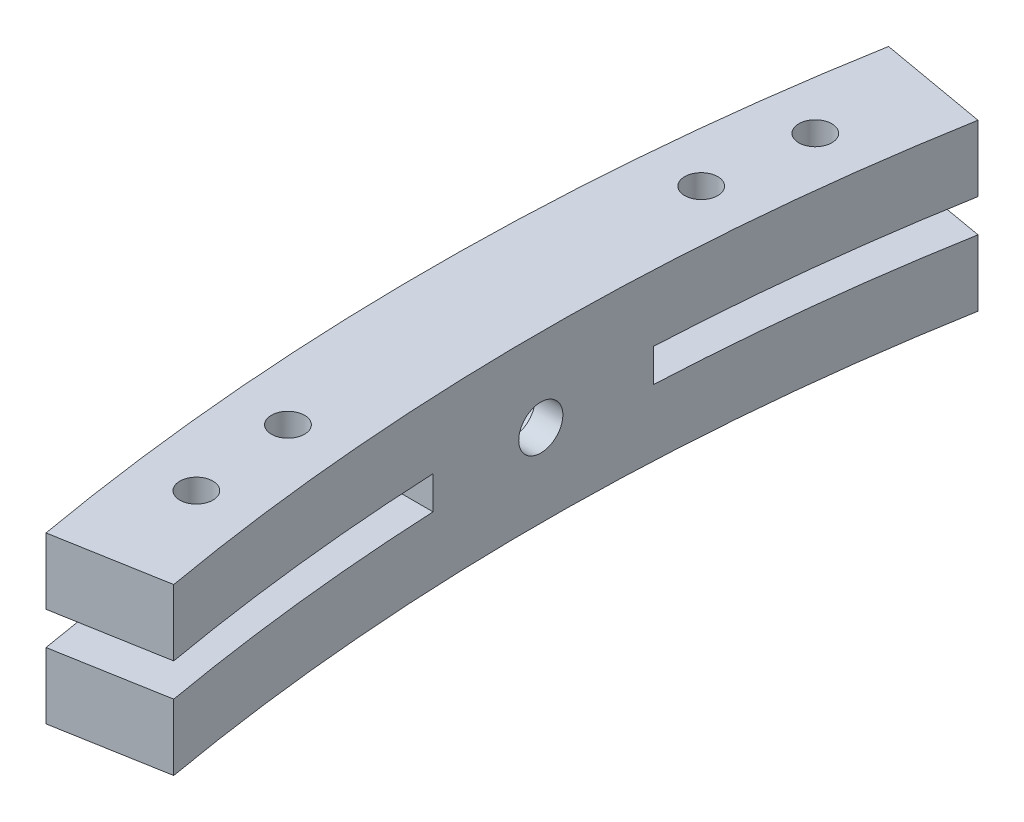
from build123d import *

# Parameters (mm, degrees)
BASE2_DEPTH            = 7.5
MOUNT2_START           = -1.5
MOUNT2_DEPTH           = 3
MOUNT_HOLE2_DEPTH      = 224.418192135
MOUNT_HOLE2_DEPTH_BACK = 224.418192135
SKETCH16_R             = 1.5
SKETCH17_R             = 2
SHAFT_HOLE_DEPTH       = 40.784051683
SKETCH18_W             = 2.5
SKETCH18_H             = 3.5


with BuildPart() as part:
    # Sketch13 → base2 (new, symmetric)
    with BuildSketch(Plane(origin=(0, 0, 0), x_dir=(1, 0, 0), z_dir=(0, 1, 0))):
        with BuildLine():
            ThreePointArc((-209.761769634, 10), (-208.70564487, 23.279901188), (-206.809628133, 36.46611731))
            Line((-206.809628133, 36.46611731), (-216.657705663, 38.202599087))
            ThreePointArc((-216.657705663, 38.202599087), (-218.670303662, 24.151569236), (-219.772609758, 10))
            Line((-219.772609758, 10), (-209.761769634, 10))
        make_face()
        with BuildLine():
            ThreePointArc((-209.761769634, -10), (-210, 0), (-209.761769634, 10))
            Line((-209.761769634, 10), (-219.772609758, 10))
            ThreePointArc((-219.772609758, 10), (-220, 0), (-219.772609758, -10))
            Line((-219.772609758, -10), (-209.761769634, -10))
        make_face()
        with BuildLine():
            Line((-216.657705663, -38.202599087), (-206.809628133, -36.46611731))
            ThreePointArc((-206.809628133, -36.46611731), (-208.70564487, -23.279901188), (-209.761769634, -10))
            Line((-209.761769634, -10), (-219.772609758, -10))
            ThreePointArc((-219.772609758, -10), (-218.670303662, -24.151569236), (-216.657705663, -38.202599087))
        make_face()
    extrude(amount=BASE2_DEPTH, both=True)

    # Sketch14 → mount2 (cut)
    with BuildSketch(Plane(origin=(0, 0, 0), x_dir=(1, 0, 0), z_dir=(0, 1, 0)).offset(MOUNT2_START)):
        with BuildLine():
            Line((-209.761769634, -10), (-219.772609758, -10))
            ThreePointArc((-219.772609758, -10), (-218.670303662, -24.151569236), (-216.657705663, -38.202599087))
            Line((-216.657705663, -38.202599087), (-206.809628133, -36.46611731))
            ThreePointArc((-206.809628133, -36.46611731), (-208.70564487, -23.279901188), (-209.761769634, -10))
        make_face()
        with BuildLine():
            Line((-209.761769634, 10), (-219.772609758, 10))
            ThreePointArc((-219.772609758, 10), (-218.670303662, 24.151569236), (-216.657705663, 38.202599087))
            Line((-216.657705663, 38.202599087), (-206.809628133, 36.46611731))
            ThreePointArc((-206.809628133, 36.46611731), (-208.70564487, 23.279901188), (-209.761769634, 10))
        make_face()
    extrude(amount=MOUNT2_DEPTH, mode=Mode.SUBTRACT)

    # Sketch16 → mount hole2 (cut, two sides: drawn at the far end of the back side and taken through both)
    with BuildSketch(Plane(origin=(0, 0, 0), x_dir=(1, 0, 0), z_dir=(0, 1, 0)).offset(-MOUNT_HOLE2_DEPTH_BACK)):
        with Locations(Location((-213.160645195, 28.063131327, 0), (0, 0, 270))):
            Circle(SKETCH16_R)
        with Locations(Location((-214.18186009, 18.738484691, 0), (0, 0, 270))):
            Circle(SKETCH16_R)
        with Locations(Location((-214.18186009, -18.738484691, 0), (0, 0, 270))):
            Circle(SKETCH16_R)
        with Locations(Location((-213.160645195, -28.063131327, 0), (0, 0, 270))):
            Circle(SKETCH16_R)
    extrude(amount=MOUNT_HOLE2_DEPTH + MOUNT_HOLE2_DEPTH_BACK, mode=Mode.SUBTRACT)

    # Sketch17 → shaft hole (cut, through all)
    with BuildSketch(Plane(origin=(-215, 0, 0), x_dir=(0, 0, -1), z_dir=(1, 0, 0))):
        with Locations(Location((0, 0, 0), (0, 0, 180))):
            Circle(SKETCH17_R)
    extrude(amount=SHAFT_HOLE_DEPTH, mode=Mode.SUBTRACT)

    # Sketch18 → bearinghole (revolve, cut)
    with BuildSketch(Plane(origin=(0, 0, 0), x_dir=(1, 0, 0), z_dir=(0, 1, 0)), mode=Mode.PRIVATE) as bearinghole_sk:
        with Locations((-213.75, 1.75)):
            Rectangle(SKETCH18_W, SKETCH18_H)
    revolve(bearinghole_sk.sketch.rotate(Axis((-215, 0, 0), (1, 0, 0)), 180), axis=Axis((-215, 0, 0), (1, 0, 0)), mode=Mode.SUBTRACT)


solid = part.part
